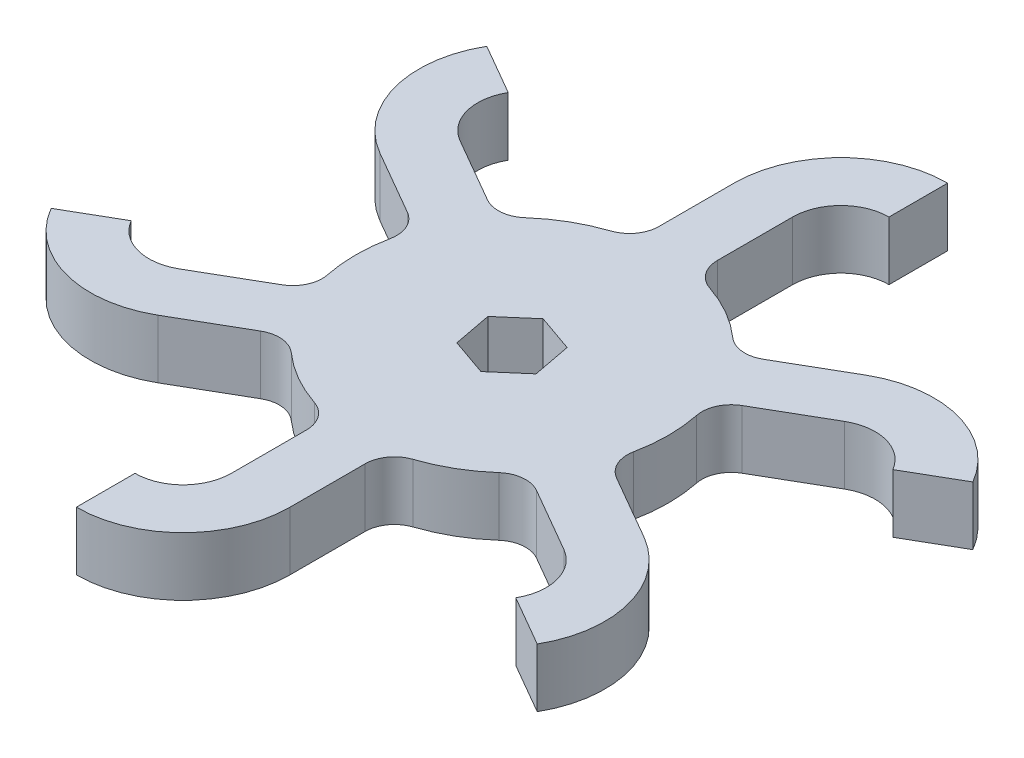
from build123d import *

# Parameters (mm, degrees)
EXTRUDE_1_DEPTH          = 6
PATTERN_CIRCULAR_1_COUNT = 6
FILLET_1_R               = 3


with BuildPart() as part:
    # 草图1 → 凸台-拉伸1 (new body)
    with BuildSketch(Plane(origin=(0, 0, 0), x_dir=(1, 0, 0), z_dir=(0, 1, 0))):
        with BuildLine():
            Line((-3, 15.716233646), (-3, 25.716233646))
            ThreePointArc((-3, 25.716233646), (0.201439561, 33.447280184), (7.931262854, 36.651672125))
            Line((7.931262854, 36.651672125), (7.931262854, 30.651671155))
            ThreePointArc((7.931262854, 30.651671155), (4.44408042, 29.204639325), (3, 25.716233646))
            Line((3, 25.716233646), (3, 15.716233646))
            ThreePointArc((3, 15.716233646), (8, 13.856406461), (12.110657589, 10.456193034))
            Line((12.110657589, 10.456193034), (3.027664397, 2.614048259))
            Line((3.027664397, 2.614048259), (-0.75, 3.929058411))
            Line((-0.75, 3.929058411), (-3, 15.716233646))
        make_face()
    extrude_1 = extrude(amount=EXTRUDE_1_DEPTH)

    # 阵列(圆周)1: 凸台-拉伸1 ×6 about axis
    pattern_circular_1_axis = Axis((0, 0, 0), (0, 1, 0))
    for i in range(1, PATTERN_CIRCULAR_1_COUNT):
        add(extrude_1.rotate(pattern_circular_1_axis, i * 360 / PATTERN_CIRCULAR_1_COUNT))

    # 圆角1
    fillet_1_edges = [part.edges().sort_by_distance(p)[0] for p in [
        (-3, 3, -15.716233646),
        (3, 3, -15.716233646),
        (12.110657589, 3, -10.456193034),
        (-12.110657589, 3, -10.456193034),
        (-15.110657589, 3, -5.260040611),
        (-15.110657589, 3, 5.260040611),
        (-12.110657589, 3, 10.456193034),
        (-3, 3, 15.716233646),
        (3, 3, 15.716233646),
        (12.110657589, 3, 10.456193034),
        (15.110657589, 3, 5.260040611),
        (15.110657589, 3, -5.260040611),
    ]]
    fillet(fillet_1_edges, radius=FILLET_1_R)


solid = part.part
